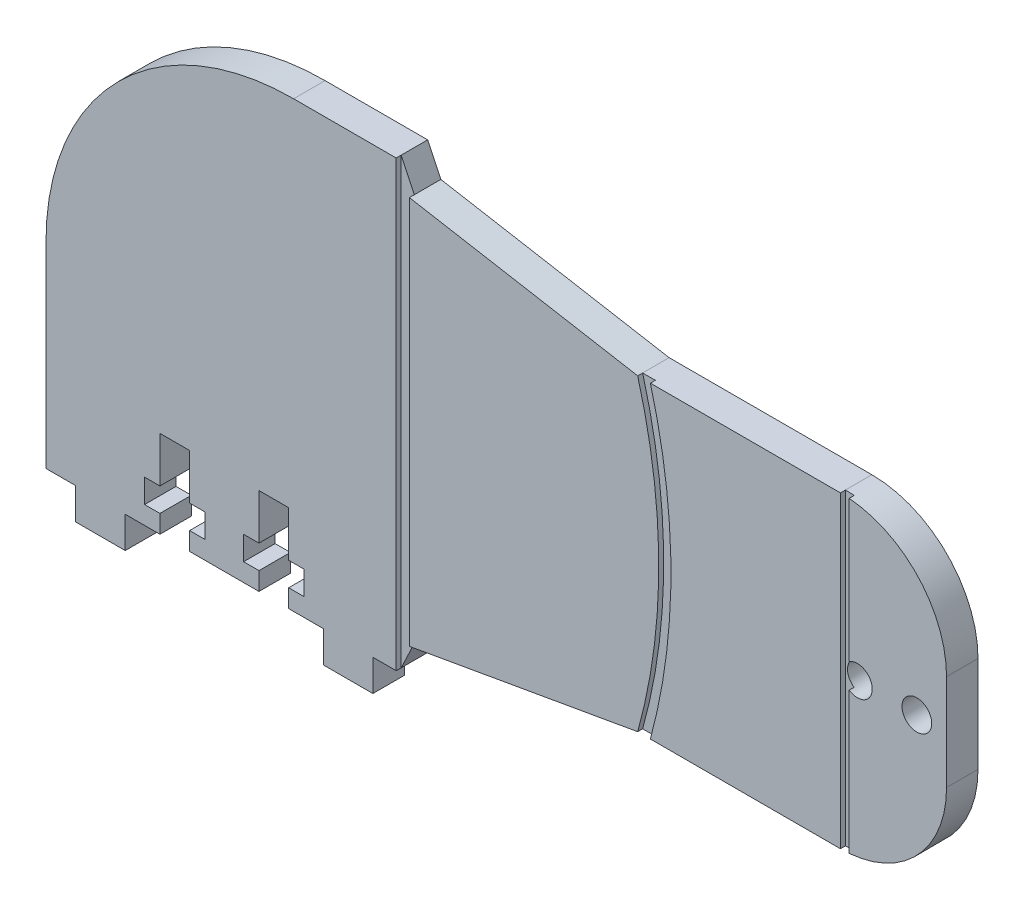
from build123d import *

# Parameters (mm, degrees)
BOSS_EXTRUDE1_DEPTH = 3.175
SKETCH2_W           = 5
SKETCH2_H           = 3.175
BOSS_EXTRUDE2_DEPTH = 3.175
CUT_EXTRUDE1_DEPTH  = 93.974208943
CUT_EXTRUDE4_START  = -0.5
CUT_EXTRUDE4_DEPTH  = 0.5
CUT_EXTRUDE5_DEPTH  = 93.974208943
SKETCH6_R           = 1.5
CUT_EXTRUDE6_DEPTH  = 93.974208943


with BuildPart() as part:
    # Sketch1 → Boss-Extrude1 (new body)
    with BuildSketch(Plane.XY):
        with BuildLine():
            Line((70.685056323, 37.961813727), (50.215098345, 37.961813727))
            Line((50.215098345, 37.961813727), (27.166207813, 42.019918966))
            Line((27.166207813, 42.019918966), (25.837789145, 44.817651071))
            Line((25.837789145, 44.817651071), (-9.51883745, 44.817651071))
            Line((-9.51883745, 44.817651071), (-9.51883745, -0.009767361))
            Line((-9.51883745, -0.009767361), (25.837789145, -0.009767361))
            Line((25.837789145, -0.009767361), (27.166207813, 2.787964744))
            Line((27.166207813, 2.787964744), (50.215098345, 6.846069984))
            Line((50.215098345, 6.846069984), (70.685056323, 6.846069984))
            ThreePointArc((70.685056323, 6.846069984), (78.259672242, 9.983578627), (81.397180885, 17.558194546))
            Line((81.397180885, 17.558194546), (81.397180885, 22.403941855))
            Line((81.397180885, 22.403941855), (81.397180885, 27.249689164))
            ThreePointArc((81.397180885, 27.249689164), (78.259672242, 34.824305083), (70.685056323, 37.961813727))
        make_face()
    extrude(amount=BOSS_EXTRUDE1_DEPTH)

    # Sketch2 → Boss-Extrude2 (add)
    with BuildSketch(Plane.XY.offset(3.175)):
        with Locations((-4.01883745, -1.597267361)):
            Rectangle(SKETCH2_W, SKETCH2_H)
        with Locations((20.98116255, -1.597267361)):
            Rectangle(SKETCH2_W, SKETCH2_H)
    extrude(amount=-BOSS_EXTRUDE2_DEPTH)

    # Sketch3 → Cut-Extrude1 (cut, through all)
    with BuildSketch(Plane.XY.offset(3.175)):
        Polygon((4.98116255, -0.009767361), (1.98116255, -0.009767361), (1.98116255, 1.815232639), (0.43116255, 1.815232639), (0.43116255, 4.215232639), (1.98116255, 4.215232639), (1.98116255, 8.815232639), (4.98116255, 8.815232639), (4.98116255, 4.215232639), (6.53116255, 4.215232639), (6.53116255, 1.815232639), (4.98116255, 1.815232639), align=None)
        Polygon((11.98116255, -0.009767361), (11.98116255, 1.815232639), (10.43116255, 1.815232639), (10.43116255, 4.215232639), (11.98116255, 4.215232639), (11.98116255, 8.815232639), (14.98116255, 8.815232639), (14.98116255, 4.215232639), (16.53116255, 4.215232639), (16.53116255, 1.815232639), (14.98116255, 1.815232639), (14.98116255, -0.009767361), align=None)
    extrude(amount=-CUT_EXTRUDE1_DEPTH, mode=Mode.SUBTRACT)

    # Sketch4 → Cut-Extrude4 (cut)
    with BuildSketch(Plane.XY.offset(3.175).offset(CUT_EXTRUDE4_START)):
        Polygon((25.837789145, 22.403941855), (27.166207813, 22.403941855), (27.166207813, 42.019918966), (25.837789145, 44.817651071), align=None)
        Polygon((27.166207813, 2.787964744), (27.166207813, 22.403941855), (25.837789145, 22.403941855), (25.837789145, -0.009767361), align=None)
        with BuildLine():
            Line((50.215098345, 6.846069984), (51.495792338, 6.846069984))
            ThreePointArc((51.495792338, 6.846069984), (53.570887609, 22.403941855), (51.495792338, 37.961813727))
            Line((51.495792338, 37.961813727), (50.215098345, 37.961813727))
            ThreePointArc((50.215098345, 37.961813727), (52.343297045, 22.403941855), (50.215098345, 6.846069984))
        make_face()
        with BuildLine():
            Line((70.685056323, 37.961813727), (70.685056323, 6.846069984))
            ThreePointArc((70.685056323, 6.846069984), (71.126055593, 6.855151414), (71.56630713, 6.882380308))
            Line((71.56630713, 6.882380308), (71.56630713, 37.925503403))
            ThreePointArc((71.56630713, 37.925503403), (71.126055593, 37.952732296), (70.685056323, 37.961813727))
        make_face()
    extrude(amount=CUT_EXTRUDE4_DEPTH, mode=Mode.SUBTRACT)

    # Sketch5 → Cut-Extrude5 (cut, through all)
    with BuildSketch(Plane.XY.offset(3.175)):
        with BuildLine():
            Line((-9.51883745, 44.817651071), (15.48116255, 44.817651071))
            ThreePointArc((15.48116255, 44.817651071), (-2.196506979, 37.495320601), (-9.51883745, 19.817651071))
            Line((-9.51883745, 19.817651071), (-9.51883745, 44.817651071))
        make_face()
    extrude(amount=-CUT_EXTRUDE5_DEPTH, mode=Mode.SUBTRACT)

    # Sketch6 → Cut-Extrude6 (cut, through all)
    with BuildSketch(Plane(origin=(0, 0, 0), x_dir=(-1, 0, 0), z_dir=(0, 0, -1))):
        with Locations((-78.397180885, 22.403941855)):
            Circle(SKETCH6_R)
        with Locations((-72.397180885, 22.403941855)):
            Circle(SKETCH6_R)
    extrude(amount=-CUT_EXTRUDE6_DEPTH, mode=Mode.SUBTRACT)


solid = part.part
